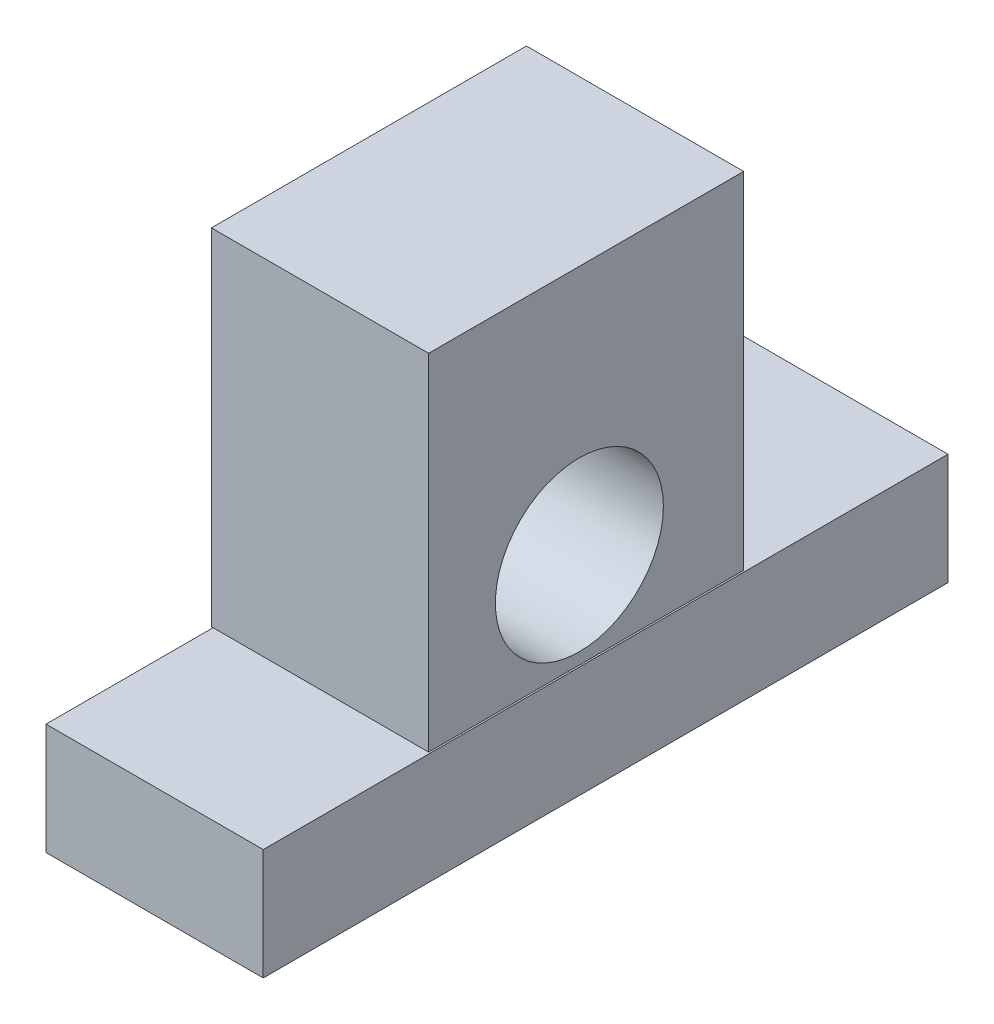
from build123d import *

# Parameters (mm, degrees)
SKETCH1_W           = 46.0375
SKETCH1_H           = 50.4825
SKETCH1_R           = 12.277280792
BOSS_EXTRUDE1_DEPTH = 31.75
SKETCH3_W           = 31.75
SKETCH3_H           = 100.076
BOSS_EXTRUDE3_DEPTH = 16.256


with BuildPart() as part:
    # Sketch1 → Boss-Extrude1 (new body)
    with BuildSketch(Plane(origin=(0, 0, 0), x_dir=(0, 0, -1), z_dir=(1, 0, 0))):
        with Locations((0.991238038, 11.27125)):
            Rectangle(SKETCH1_W, SKETCH1_H)
        Circle(SKETCH1_R, mode=Mode.SUBTRACT)
    extrude(amount=BOSS_EXTRUDE1_DEPTH)

    # Sketch3 → Boss-Extrude3 (add)
    with BuildSketch(Plane(origin=(0, -13.97, 0), x_dir=(-1, 0, 0), z_dir=(0, -1, 0))):
        with Locations((-16.117688266, 3.592032026)):
            Rectangle(SKETCH3_W, SKETCH3_H)
    extrude(amount=BOSS_EXTRUDE3_DEPTH)


solid = part.part
